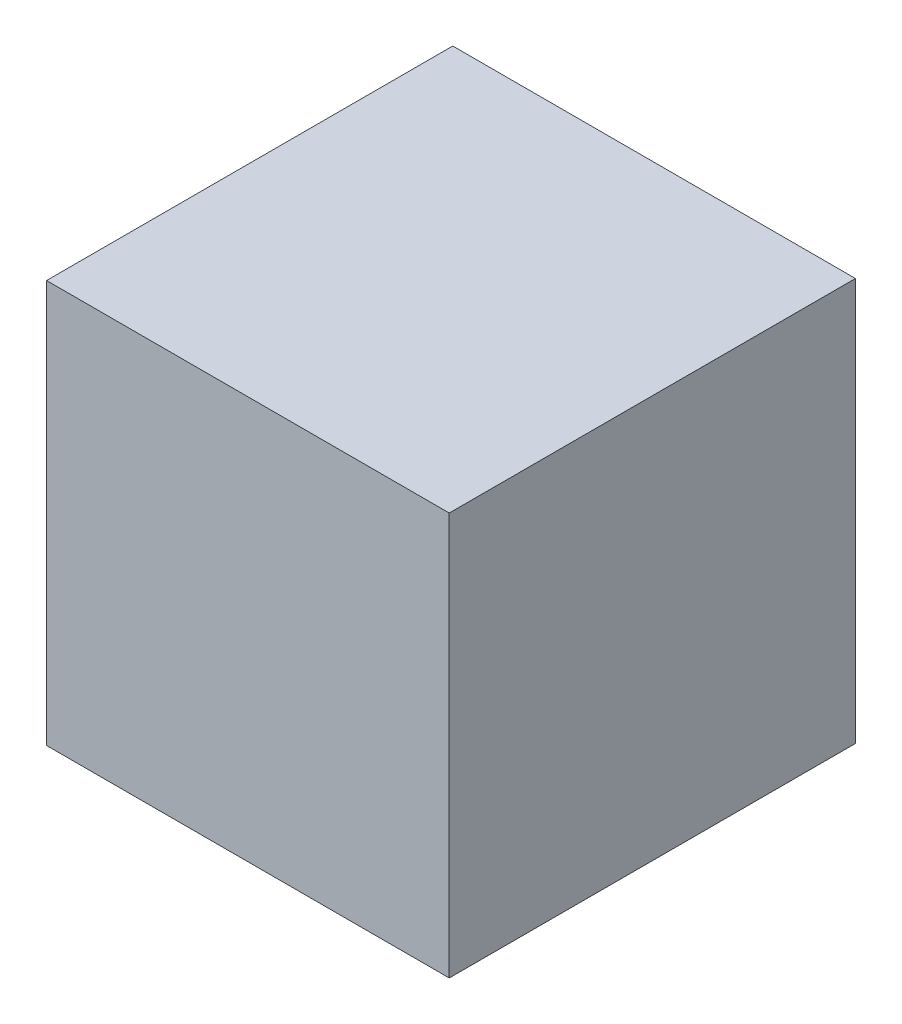
from build123d import *

# Parameters (mm, degrees)
SKETCH1_W           = 20
SKETCH1_H           = 20
BOSS_EXTRUDE1_DEPTH = 20.174524064


with BuildPart() as part:
    # Sketch1 → Boss-Extrude1 (new body)
    with BuildSketch(Plane.XY):
        with Locations((10, 10)):
            Rectangle(SKETCH1_W, SKETCH1_H)
    extrude(amount=BOSS_EXTRUDE1_DEPTH)


solid = part.part
